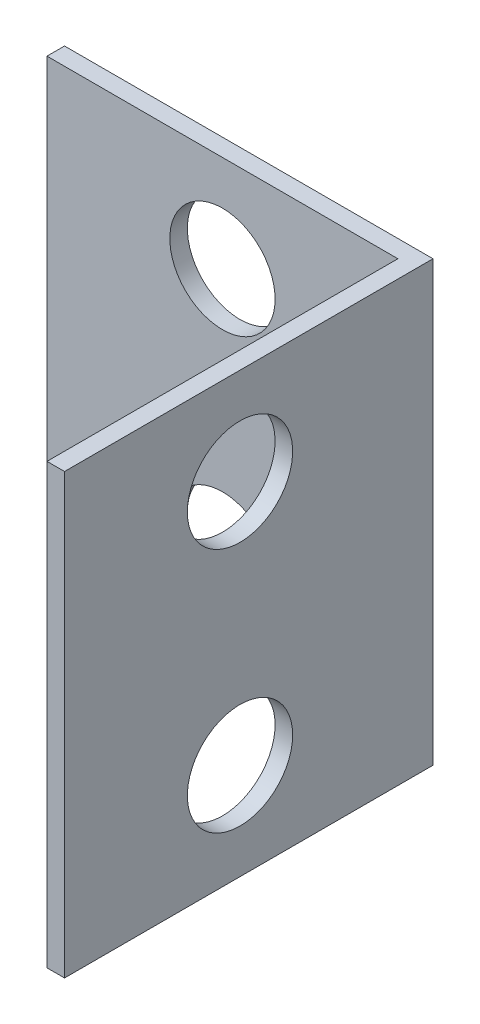
from build123d import *

# Parameters (mm, degrees)
SKETCH1_W           = 20
SKETCH1_H           = 25
BOSS_EXTRUDE1_DEPTH = 1
SKETCH3_W           = 21
SKETCH3_H           = 25
BOSS_EXTRUDE2_DEPTH = 1
SKETCH4_R           = 3
CUT_EXTRUDE1_DEPTH  = 27.024027359
SKETCH5_R           = 3
CUT_EXTRUDE2_DEPTH  = 32.579265349


with BuildPart() as part:
    # Sketch1 → Boss-Extrude1 (new body)
    with BuildSketch(Plane.XY):
        Rectangle(SKETCH1_W, SKETCH1_H)
    extrude(amount=BOSS_EXTRUDE1_DEPTH)

    # Sketch3 → Boss-Extrude2 (add)
    with BuildSketch(Plane(origin=(10, 0, 0), x_dir=(0, 0, -1), z_dir=(1, 0, 0))):
        with Locations((-10.5, 0)):
            Rectangle(SKETCH3_W, SKETCH3_H)
    extrude(amount=BOSS_EXTRUDE2_DEPTH)

    # Sketch4 → Cut-Extrude1 (cut, through all)
    with BuildSketch(Plane.XY.offset(1)):
        with Locations((0, 7)):
            Circle(SKETCH4_R)
        with Locations(Location((0, -7, 0), (0, 0, 180))):
            Circle(SKETCH4_R)
    extrude(amount=-CUT_EXTRUDE1_DEPTH, mode=Mode.SUBTRACT)

    # Sketch5 → Cut-Extrude2 (cut, through all)
    with BuildSketch(Plane.ZY.offset(-10)):
        with Locations((11, 7)):
            Circle(SKETCH5_R)
        with Locations(Location((11, -7, 0), (0, 0, 180))):
            Circle(SKETCH5_R)
    extrude(amount=-CUT_EXTRUDE2_DEPTH, mode=Mode.SUBTRACT)


solid = part.part
